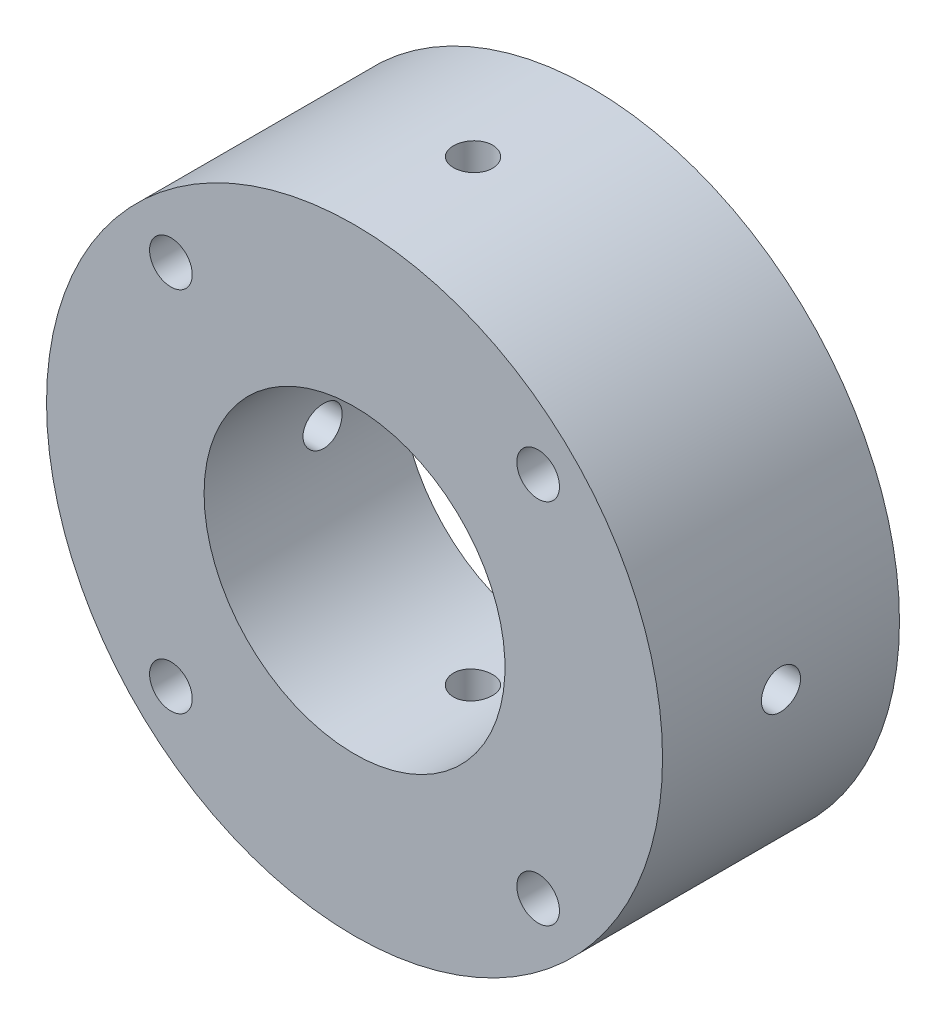
from build123d import *

# Parameters (mm, degrees)
SKETCH1_W                      = 26
SKETCH1_H                      = 20
M3X0_5_TAPPED_HOLE1_D          = 2.5
M3X0_5_TAPPED_HOLE1_DEPTH      = 6
M3X0_5_TAPPED_HOLE1_TIP        = 0.751075774
HOLE1_D                        = 25.4
HOLE1_CBORE_D                  = 40
HOLE1_CBORE_DEPTH              = 3.4
M4X0_7_TAPPED_HOLE1_D          = 3.3
M4X0_7_TAPPED_HOLE2_D          = 3.3
M4X0_7_TAPPED_HOLE2_DEPTH      = 13.407641206
F_4_CLEARANCE_HOLE3_D          = 3.3
CBORE_FOR_M3_SHCS1_D           = 3.6
CBORE_FOR_M3_SHCS1_CBORE_D     = 6.5
CBORE_FOR_M3_SHCS1_CBORE_DEPTH = 7.5


with BuildPart() as part:
    # Sketch1 → Revolve1 (revolve)
    with BuildSketch(Plane.XZ, mode=Mode.PRIVATE) as revolve1_sk:
        with Locations((13, 10)):
            Rectangle(SKETCH1_W, SKETCH1_H)
    revolve(revolve1_sk.sketch.rotate(Axis((0, 0, 20), (0, 0, -1)), 180), axis=Axis((0, 0, 20), (0, 0, -1)))

    # M3x0.5 Tapped Hole1
    with Locations(Plane(origin=(0, 0, 0), x_dir=(-1, 0, 0), z_dir=(0, 0, -1))):
        with Locations((-22.776165581, 3.200981322)):
            Hole(M3X0_5_TAPPED_HOLE1_D / 2, depth=M3X0_5_TAPPED_HOLE1_DEPTH)
            with Locations((0, 0, -(M3X0_5_TAPPED_HOLE1_DEPTH + M3X0_5_TAPPED_HOLE1_TIP / 2))):  # 118° drill point
                Cone(0, M3X0_5_TAPPED_HOLE1_D / 2, M3X0_5_TAPPED_HOLE1_TIP, mode=Mode.SUBTRACT)

    # Hole1 (through all)
    with Locations(Plane(origin=(0, 0, 0), x_dir=(-1, 0, 0), z_dir=(0, 0, -1))):
        with Locations((0, 0)):
            CounterBoreHole(HOLE1_D / 2, HOLE1_CBORE_D / 2, HOLE1_CBORE_DEPTH)

    # M4x0.7 Tapped Hole1 (through all)
    with Locations(Plane(origin=(26, 0, 10), x_dir=(0, 1, 0), z_dir=(1, 0, 0))):
        with Locations((0, 0)):
            Hole(M4X0_7_TAPPED_HOLE1_D / 2)

    # M4x0.7 Tapped Hole2
    with Locations(Plane(origin=(0, 12.592358794, 0), x_dir=(-1, 0, 0), z_dir=(0, -1, 0))):
        with Locations((0, -10)):
            Hole(M4X0_7_TAPPED_HOLE2_D / 2, depth=M4X0_7_TAPPED_HOLE2_DEPTH)

    # #4 Clearance Hole3 (through all)
    with Locations(Plane(origin=(0, -12.592358794, 0), x_dir=(1, 0, 0), z_dir=(0, 1, 0))):
        with Locations((0, -10)):
            Hole(F_4_CLEARANCE_HOLE3_D / 2)

    # CBORE for M3 SHCS1 (through all)
    with Locations(Plane(origin=(0, 0, 0), x_dir=(-1, 0, 0), z_dir=(0, 0, -1))):
        with Locations((-15.5, -15.5), (-15.5, 15.5), (15.5, 15.5), (15.5, -15.5)):
            CounterBoreHole(CBORE_FOR_M3_SHCS1_D / 2, CBORE_FOR_M3_SHCS1_CBORE_D / 2, CBORE_FOR_M3_SHCS1_CBORE_DEPTH)


solid = part.part
